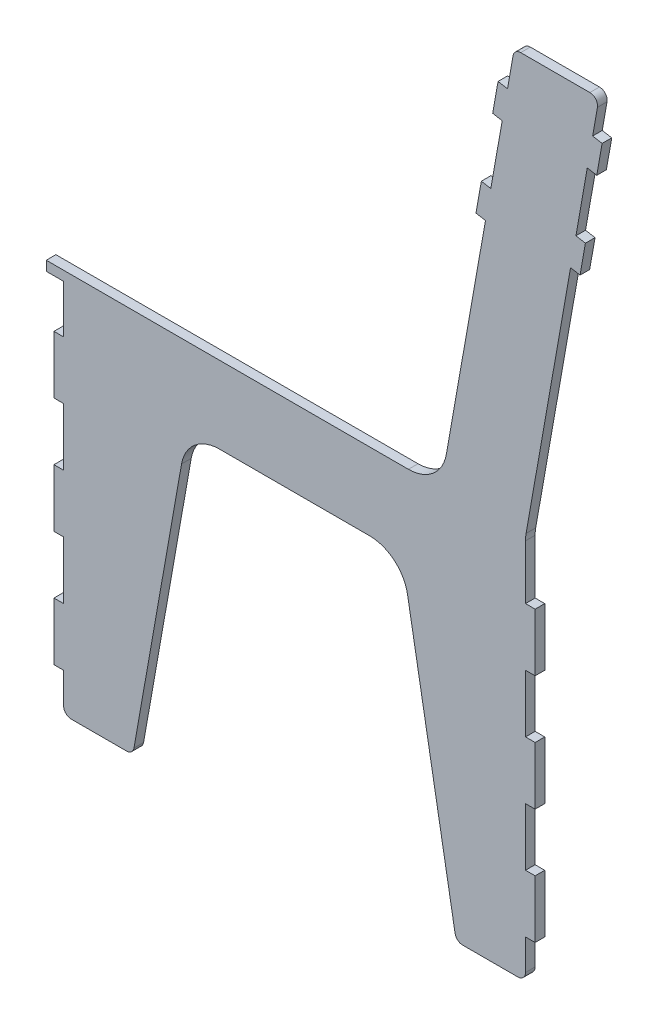
from build123d import *

# Parameters (mm, degrees)
BOSS_EXTRUDE1_DEPTH = 2.5
FILLET1_R           = 2
FILLET2_R           = 10


with BuildPart() as part:
    # Sketch1 → Boss-Extrude1 (new body)
    with BuildSketch(Plane.XY):
        Polygon((-42, -90), (-27.893841543, -10), (27.893841543, -10), (42, -90), (60, -90), (60, -80), (62.5, -80), (62.5, -65), (60, -65), (60, -50), (62.5, -50), (62.5, -35), (60, -35), (60, -20), (62.5, -20), (62.5, -5), (60, -5), (60, 10), (71.710975051, 76.416239896), (74.172994433, 75.982119452), (75.562179855, 83.860581476), (73.100160472, 84.29470192), (76.052179493, 101.036433721), (78.514198875, 100.602313277), (79.903384296, 108.480775301), (77.441364914, 108.914895745), (79.101299543, 118.328852831), (57.068895795, 118.328852831), (55.332414019, 108.480775301), (52.870394636, 108.914895745), (51.481209215, 101.036433721), (53.943228597, 100.602313277), (50.991209577, 83.860581476), (48.529190194, 84.29470192), (47.140004773, 76.416239896), (49.602024156, 75.982119452), (37.967596252, 10), (-64.5, 10), (-64.5, 7.5), (-60, 7.5), (-60, -5), (-62.5, -5), (-62.5, -20), (-60, -20), (-60, -35), (-62.5, -35), (-62.5, -50), (-60, -50), (-60, -65), (-62.5, -65), (-62.5, -80), (-60, -80), (-60, -90), align=None)
    extrude(amount=BOSS_EXTRUDE1_DEPTH)

    # Fillet1
    fillet1_edges = [part.edges().sort_by_distance(p)[0] for p in [
        (60, -90, 1.25),
        (42, -90, 1.25),
        (-42, -90, 1.25),
        (-60, -90, 1.25),
        (57.068895795, 118.328852831, 1.25),
        (79.101299543, 118.328852831, 1.25),
    ]]
    fillet(fillet1_edges, radius=FILLET1_R)

    # Fillet2
    fillet2_edges = [part.edges().sort_by_distance(p)[0] for p in [
        (27.893841543, -10, 1.25),
        (-27.893841543, -10, 1.25),
        (37.967596252, 10, 1.25),
        (60, 10, 1.25),
    ]]
    fillet(fillet2_edges, radius=FILLET2_R)


solid = part.part
